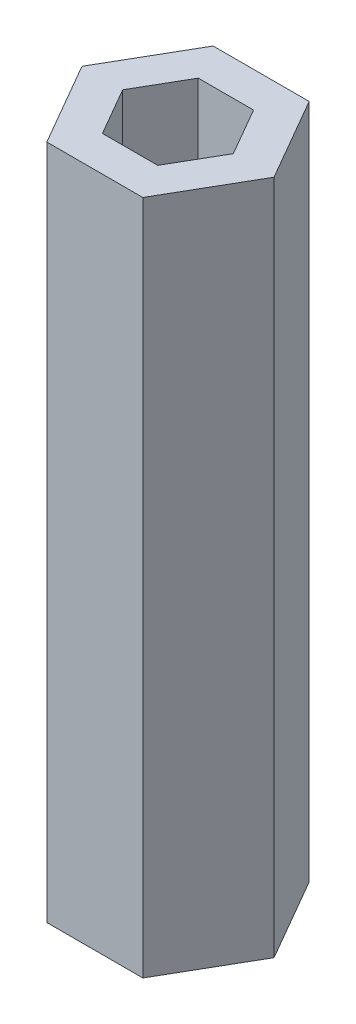
from build123d import *

# Parameters (mm, degrees)
BOSS_EXTRUDE1_DEPTH = 50.8


with BuildPart() as part:
    # Sketch1 → Boss-Extrude1 (new body)
    with BuildSketch(Plane(origin=(0, 0, 0), x_dir=(1, 0, 0), z_dir=(0, 1, 0))):
        Polygon((3.608439182, 6.25), (-3.608439182, 6.25), (-7.216878365, 0), (-3.608439182, -6.25), (3.608439182, -6.25), (7.216878365, 0), align=None)
        Polygon((2.078460969, 3.6), (-2.078460969, 3.6), (-4.156921938, 0), (-2.078460969, -3.6), (2.078460969, -3.6), (4.156921938, 0), align=None, mode=Mode.SUBTRACT)
    extrude(amount=BOSS_EXTRUDE1_DEPTH)


solid = part.part
